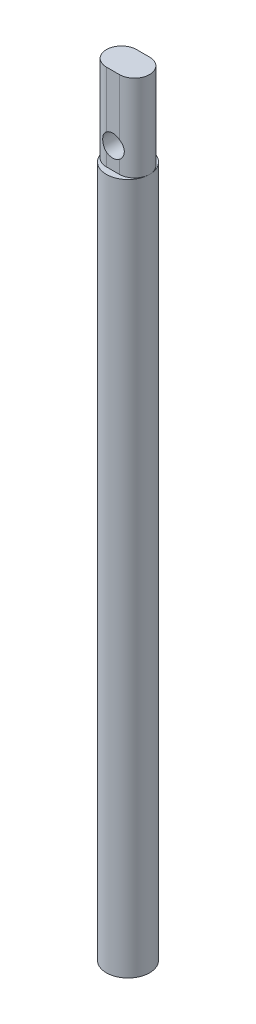
from build123d import *

# Parameters (mm, degrees)
SKETCH1_R           = 5
BOSS_EXTRUDE1_DEPTH = 160
BOSS_EXTRUDE2_DEPTH = 20
SKETCH3_R           = 2.5
CUT_EXTRUDE1_DEPTH  = 10


with BuildPart() as part:
    # Sketch1 → Boss-Extrude1 (new body)
    with BuildSketch(Plane(origin=(0, 0, 0), x_dir=(1, 0, 0), z_dir=(0, 1, 0))):
        with Locations(Location((0, 0, 0), (0, 0, 270))):
            Circle(SKETCH1_R)
    extrude(amount=BOSS_EXTRUDE1_DEPTH)

    # Sketch2 → Boss-Extrude2 (add)
    with BuildSketch(Plane(origin=(0, 160, 0), x_dir=(1, 0, 0), z_dir=(0, 1, 0))):
        with BuildLine():
            Line((1.5, -3.5), (-1.5, -3.5))
            ThreePointArc((-1.5, -3.5), (-5, 0), (-1.5, 3.5))
            Line((-1.5, 3.5), (1.5, 3.5))
            ThreePointArc((1.5, 3.5), (5, 0), (1.5, -3.5))
        make_face()
    extrude(amount=BOSS_EXTRUDE2_DEPTH)

    # Sketch3 → Cut-Extrude1 (cut)
    with BuildSketch(Plane.XY.offset(3.5)):
        with Locations(Location((0, 165, 0), (0, 0, 53.130102354))):
            Circle(SKETCH3_R)
    extrude(amount=-CUT_EXTRUDE1_DEPTH, mode=Mode.SUBTRACT)


solid = part.part
